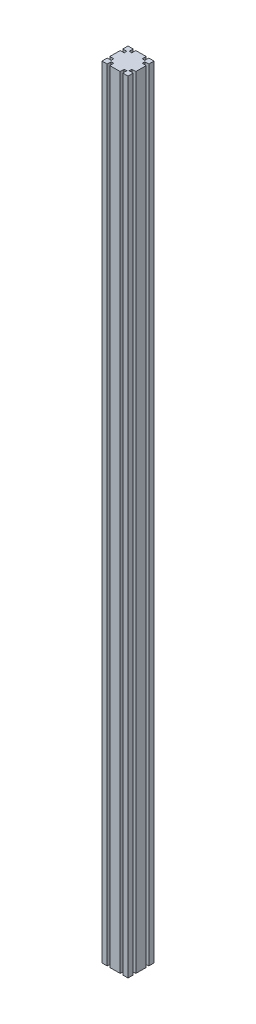
from build123d import *

# Parameters (mm, degrees)
BOSS_EXTRUDE1_DEPTH = 2400


with BuildPart() as part:
    # Sketch1 → Boss-Extrude1 (new body)
    with BuildSketch(Plane(origin=(0, 0, 0), x_dir=(1, 0, 0), z_dir=(0, 1, 0))):
        Polygon((-7.320779393, 34.479989845), (-7.320779393, 50.479989845), (8.679220607, 50.479989845), (8.679220607, 38.179989845), (16.679220607, 38.179989845), (16.679220607, 50.479989845), (48.679220607, 50.479989845), (48.679220607, 38.179989845), (56.679220607, 38.179989845), (56.679220607, 50.479989845), (72.679220607, 50.479989845), (72.679220607, 34.479989845), (60.379220607, 34.479989845), (60.379220607, 26.479989845), (72.679220607, 26.479989845), (72.679220607, -5.520010155), (60.379220607, -5.520010155), (60.379220607, -13.520010155), (72.679220607, -13.520010155), (72.679220607, -29.520010155), (56.679220607, -29.520010155), (56.679220607, -17.220010155), (48.679220607, -17.220010155), (48.679220607, -29.520010155), (16.679220607, -29.520010155), (16.679220607, -17.220010155), (8.679220607, -17.220010155), (8.679220607, -29.520010155), (-7.320779393, -29.520010155), (-7.320779393, -13.520010155), (4.979220607, -13.520010155), (4.979220607, -5.520010155), (-7.320779393, -5.520010155), (-7.320779393, 26.479989845), (4.979220607, 26.479989845), (4.979220607, 34.479989845), align=None)
    extrude(amount=BOSS_EXTRUDE1_DEPTH)


solid = part.part
